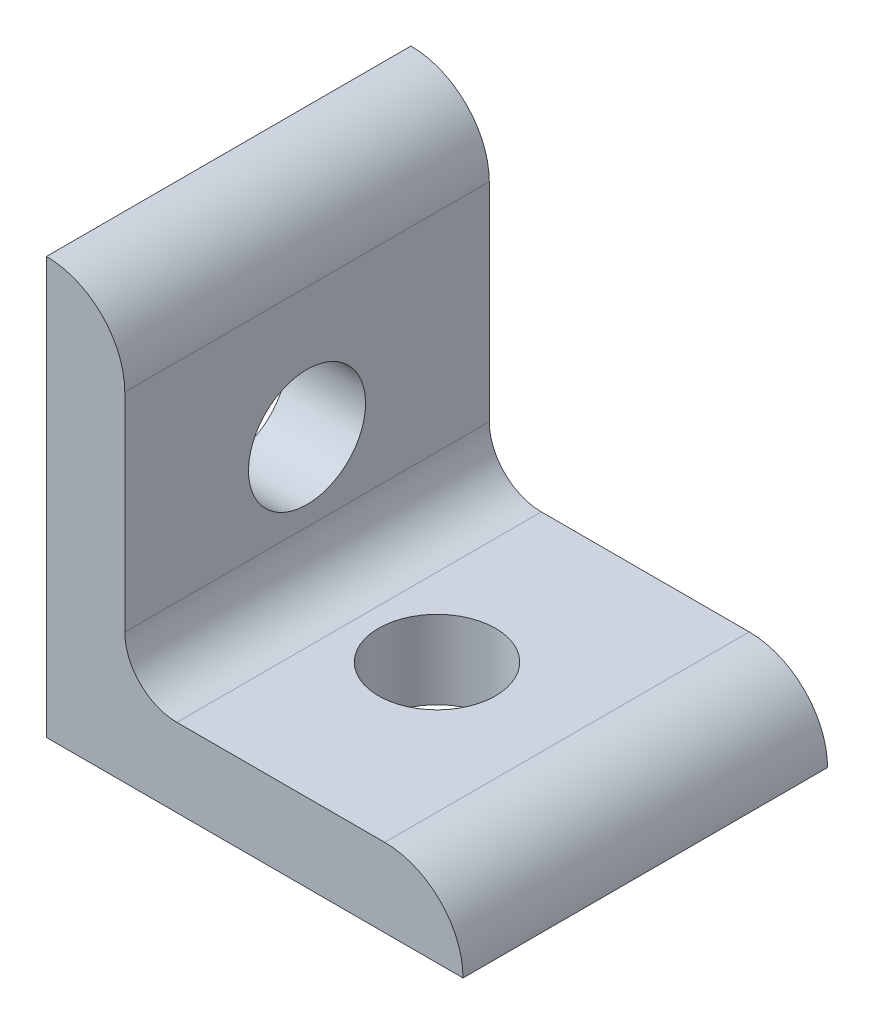
from build123d import *

# Parameters (mm, degrees)
BOSS_EXTRUDE1_DEPTH = 11.1125
SKETCH2_R           = 3.5687
CUT_EXTRUDE1_DEPTH  = 38.600633721
SKETCH3_R           = 3.5687
CUT_EXTRUDE2_DEPTH  = 38.600633721


with BuildPart() as part:
    # Sketch1 → Boss-Extrude1 (new, symmetric)
    with BuildSketch(Plane.XY):
        with BuildLine():
            Line((0, 0), (0, 25.4))
            ThreePointArc((0, 25.4), (3.376576302, 24.001376302), (4.7752, 20.6248))
            Line((4.7752, 20.6248), (4.7752, 7.9502))
            ThreePointArc((4.7752, 7.9502), (5.70513597, 5.70513597), (7.9502, 4.7752))
            Line((7.9502, 4.7752), (20.6248, 4.7752))
            ThreePointArc((20.6248, 4.7752), (24.001376302, 3.376576302), (25.4, 0))
            Line((25.4, 0), (0, 0))
        make_face()
    extrude(amount=BOSS_EXTRUDE1_DEPTH, both=True)

    # Sketch2 → Cut-Extrude1 (cut, through all)
    with BuildSketch(Plane(origin=(0, 0, 0), x_dir=(1, 0, 0), z_dir=(0, 1, 0))):
        with Locations(Location((12.7, 0, 0), (0, 0, 90))):
            Circle(SKETCH2_R)
    extrude(amount=CUT_EXTRUDE1_DEPTH, mode=Mode.SUBTRACT)

    # Sketch3 → Cut-Extrude2 (cut, through all)
    with BuildSketch(Plane(origin=(0, 0, 0), x_dir=(0, 0, -1), z_dir=(1, 0, 0))):
        with Locations(Location((0, 12.7, 0), (0, 0, 270))):
            Circle(SKETCH3_R)
    extrude(amount=CUT_EXTRUDE2_DEPTH, mode=Mode.SUBTRACT)


solid = part.part
